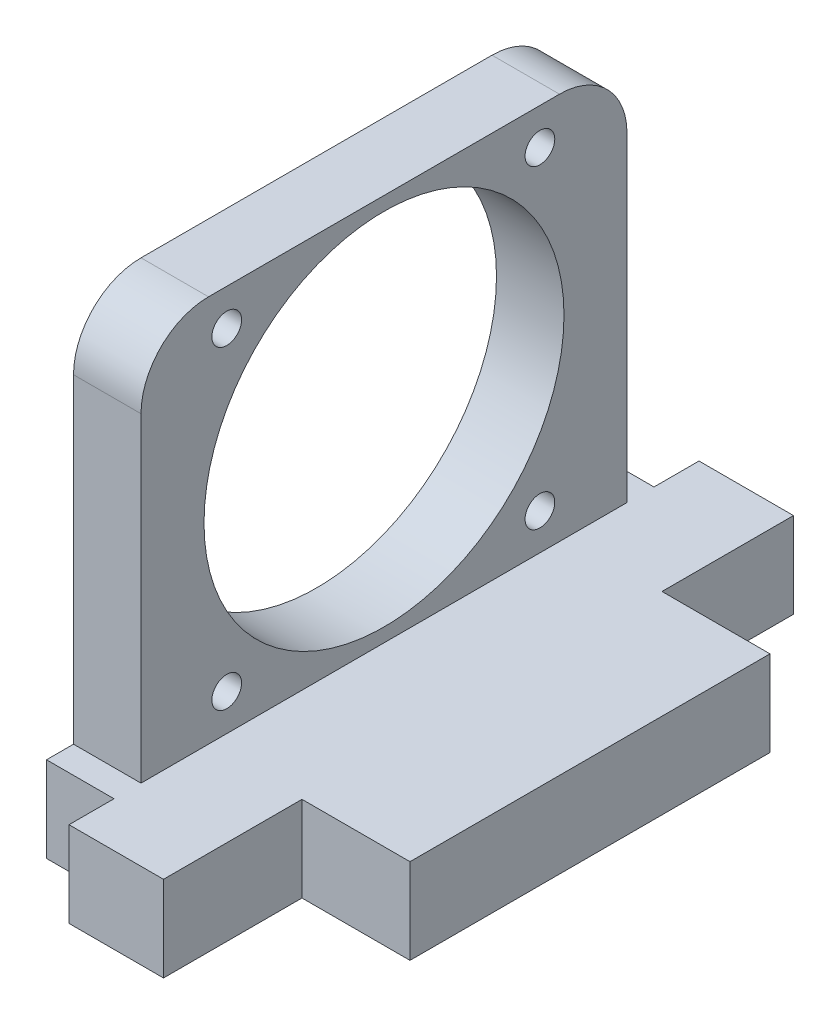
from build123d import *

# Parameters (mm, degrees)
BOSS_EXTRUDE1_DEPTH = 120
SKETCH2_R           = 40
SKETCH2_R_2         = 3.3
CUT_EXTRUDE1_DEPTH  = 166.743808331
SKETCH3_W           = 15
SKETCH3_H           = 6
CUT_EXTRUDE4_DEPTH  = 86.1
FILLET1_R           = 15
SKETCH4_W           = 24
SKETCH4_H           = 20.775598272
SKETCH4_H_2         = 19.224401728
CUT_EXTRUDE5_DEPTH  = 160.415212574
SKETCH6_W           = 21
SKETCH6_H           = 10
BOSS_EXTRUDE2_DEPTH = 19


with BuildPart() as part:
    # Sketch1 → Boss-Extrude1 (new body)
    with BuildSketch(Plane.XY):
        Polygon((0, 0), (60, 0), (60, 19), (15, 19), (15, 105.1), (0, 105.1), align=None)
    extrude(amount=BOSS_EXTRUDE1_DEPTH)

    # Sketch2 → Cut-Extrude1 (cut, through all)
    with BuildSketch(Plane(origin=(15, 0, 0), x_dir=(0, 0, -1), z_dir=(1, 0, 0))):
        with Locations((-60, 62.05)):
            Circle(SKETCH2_R)
        with Locations((-94.95, 97)):
            Circle(SKETCH2_R_2)
        with Locations((-25.35, 97)):
            Circle(SKETCH2_R_2)
        with Locations(Location((-94.95, 27.1, 0), (0, 0, 180))):
            Circle(SKETCH2_R_2)
        with Locations(Location((-25.35, 27.1, 0), (0, 0, 180))):
            Circle(SKETCH2_R_2)
    extrude(amount=-CUT_EXTRUDE1_DEPTH, mode=Mode.SUBTRACT)

    # Sketch3 → Cut-Extrude4 (cut)
    with BuildSketch(Plane(origin=(0, 19, 0), x_dir=(1, 0, 0), z_dir=(0, 1, 0))):
        with Locations((7.5, -3)):
            Rectangle(SKETCH3_W, SKETCH3_H)
        with Locations((7.5, -117)):
            Rectangle(SKETCH3_W, SKETCH3_H)
    extrude(amount=CUT_EXTRUDE4_DEPTH, mode=Mode.SUBTRACT)

    # Fillet1
    fillet1_edges = [part.edges().sort_by_distance(p)[0] for p in [
        (7.5, 105.1, 6),
        (7.5, 105.1, 114),
    ]]
    fillet(fillet1_edges, radius=FILLET1_R)

    # Sketch4 → Cut-Extrude5 (cut, through all)
    with BuildSketch(Plane(origin=(0, 19, 0), x_dir=(1, 0, 0), z_dir=(0, 1, 0))):
        with Locations((48, -109.612200864)):
            Rectangle(SKETCH4_W, SKETCH4_H)
        with Locations((48, -9.612200864)):
            Rectangle(SKETCH4_W, SKETCH4_H_2)
    extrude(amount=-CUT_EXTRUDE5_DEPTH, mode=Mode.SUBTRACT)

    # Sketch6 → Boss-Extrude2 (add)
    with BuildSketch(Plane(origin=(0, 19, 0), x_dir=(1, 0, 0), z_dir=(0, 1, 0))):
        with Locations((25.5, 5)):
            Rectangle(SKETCH6_W, SKETCH6_H)
        with Locations((25.5, -125)):
            Rectangle(SKETCH6_W, SKETCH6_H)
    extrude(amount=-BOSS_EXTRUDE2_DEPTH)


solid = part.part
